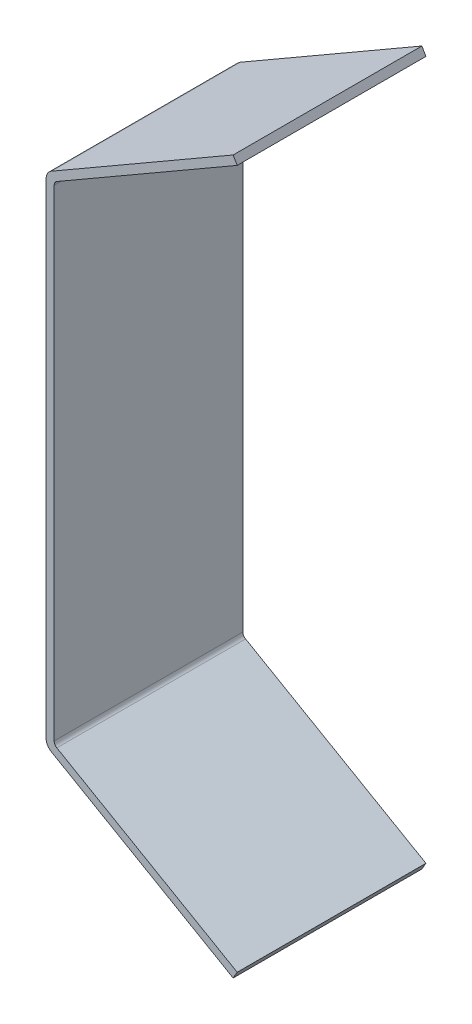
from build123d import *

# Parameters (mm, degrees)
SALIENTE_EXTRUIR1_DEPTH = 70
REDONDEO1_R             = 2
REDONDEO2_R             = 4


with BuildPart() as part:
    # Croquis1 → Saliente-Extruir1 (new body)
    with BuildSketch(Plane(origin=(0, 0, 0), x_dir=(0, 1, 0), z_dir=(0, 0, 1))):
        Polygon((-129.584937216, 88.672304845), (-90.389958144, 156.56), (90.389958144, 156.56), (129.584937216, 88.672304845), (132.183013428, 90.172304845), (92.122008952, 159.56), (-92.122008952, 159.56), (-132.183013428, 90.172304845), align=None)
    extrude(amount=SALIENTE_EXTRUIR1_DEPTH)

    # Redondeo1
    redondeo1_edges = [part.edges().sort_by_distance(p)[0] for p in [
        (-156.56, 90.389958144, 35),
        (-156.56, -90.389958144, 35),
    ]]
    fillet(redondeo1_edges, radius=REDONDEO1_R)

    # Redondeo2
    redondeo2_edges = [part.edges().sort_by_distance(p)[0] for p in [
        (-159.56, -92.122008952, 35),
        (-159.56, 92.122008952, 35),
    ]]
    fillet(redondeo2_edges, radius=REDONDEO2_R)


solid = part.part
